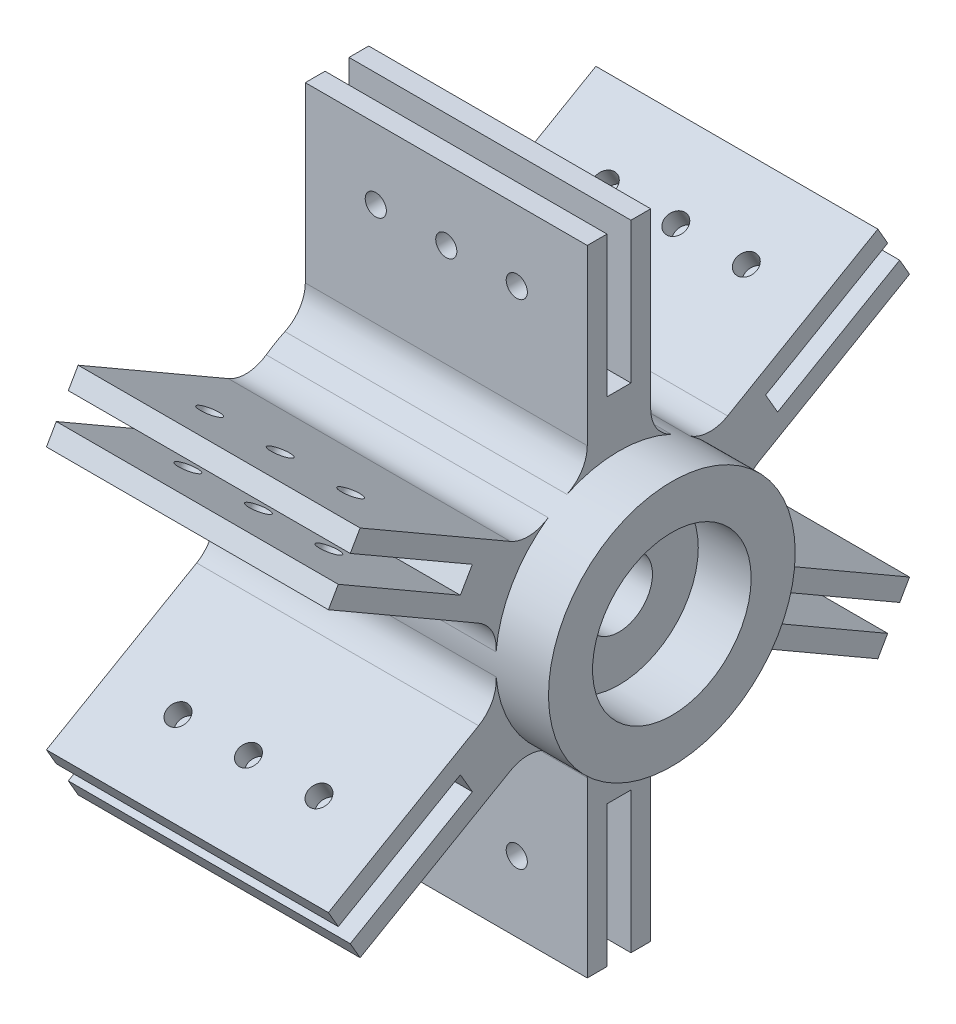
from build123d import *

# Parameters (mm, degrees)
SKETCH1_R                = 17.5
SKETCH1_R_2              = 4.75
MAINBODY_DEPTH           = 40
SKETCH2_R                = 17.5
SKETCH2_R_2              = 11.25
BEARINGHOUSING_DEPTH     = 7.5
SKETCH3_R                = 1.5
MOUNTINGHOLES_DEPTH      = 20
BOSS_EXTRUDE3_DEPTH      = 40
SKETCH6_R                = 1.5
CUT_EXTRUDE2_DEPTH       = 10
FILLET1_R                = 5
CIRPATTERN1_COUNT        = 6
FILLET1_OF_CIRPATTERN1_R = 5


with BuildPart() as part:
    # Sketch1 → MainBody (new body)
    with BuildSketch(Plane(origin=(0, 0, 0), x_dir=(0, 0, -1), z_dir=(1, 0, 0))):
        Circle(SKETCH1_R)
        Circle(SKETCH1_R_2, mode=Mode.SUBTRACT)
    extrude(amount=MAINBODY_DEPTH)

    # Sketch2 → BearingHousing (add)
    with BuildSketch(Plane(origin=(40, 0, 0), x_dir=(0, 0, -1), z_dir=(1, 0, 0))):
        Circle(SKETCH2_R)
        Circle(SKETCH2_R_2, mode=Mode.SUBTRACT)
    extrude(amount=BEARINGHOUSING_DEPTH)

    # Sketch3 → MountingHoles (cut)
    with BuildSketch(Plane.ZY):
        with Locations((0, 13)):
            Circle(SKETCH3_R)
        with Locations((11.258330249, 6.5)):
            Circle(SKETCH3_R)
        with Locations((11.258330249, -6.5)):
            Circle(SKETCH3_R)
        with Locations((0, -13)):
            Circle(SKETCH3_R)
        with Locations((-11.258330249, -6.5)):
            Circle(SKETCH3_R)
        with Locations((-11.258330249, 6.5)):
            Circle(SKETCH3_R)
    extrude(amount=-MOUNTINGHOLES_DEPTH, mode=Mode.SUBTRACT)

    # Sketch4 → Boss-Extrude3 (add)
    with BuildSketch(Plane.ZY):
        with BuildLine():
            Line((-4.5, 16.911534525), (-4.5, 45))
            Line((-4.5, 45), (-1.7, 45))
            Line((-1.7, 45), (-1.7, 25))
            Line((-1.7, 25), (1.7, 25))
            Line((1.7, 25), (1.7, 45))
            Line((1.7, 45), (4.5, 45))
            Line((4.5, 45), (4.5, 16.911534525))
            ThreePointArc((4.5, 16.911534525), (0, 17.5), (-4.5, 16.911534525))
        make_face()
    boss_extrude3 = extrude(amount=-BOSS_EXTRUDE3_DEPTH)

    # Sketch6 → Cut-Extrude2 (cut)
    with BuildSketch(Plane(origin=(0, 0, -4.5), x_dir=(-1, 0, 0), z_dir=(0, 0, -1))):
        with Locations((-30, 35)):
            Circle(SKETCH6_R)
        with Locations((-20, 35)):
            Circle(SKETCH6_R)
        with Locations((-10, 35)):
            Circle(SKETCH6_R)
    cut_extrude2 = extrude(amount=-CUT_EXTRUDE2_DEPTH, mode=Mode.SUBTRACT)

    # Fillet1
    fillet1_edges = [part.edges().sort_by_distance(p)[0] for p in [
        (20, 16.911534525, 4.5),
        (20, 16.911534525, -4.5),
    ]]
    fillet(fillet1_edges, radius=FILLET1_R)

    # CirPattern1: Boss-Extrude3, Cut-Extrude2 ×6 about axis
    cirpattern1_axis = Axis((0, 0, 0), (1, 0, 0))
    add([boss_extrude3.rotate(cirpattern1_axis, i * 360 / CIRPATTERN1_COUNT) for i in range(1, CIRPATTERN1_COUNT)])
    add([cut_extrude2.rotate(cirpattern1_axis, i * 360 / CIRPATTERN1_COUNT) for i in range(1, CIRPATTERN1_COUNT)], mode=Mode.SUBTRACT)

    # Fillet1 of CirPattern1
    fillet1_of_cirpattern1_edges = [part.edges().sort_by_distance(p)[0] for p in [
        (20, 4.558652946, 16.895818516),
        (20, 12.35288158, 12.395818516),
        (20, -12.35288158, 12.395818516),
        (20, -4.558652946, 16.895818516),
        (20, -16.911534525, -4.5),
        (20, -16.911534525, 4.5),
        (20, -4.558652946, -16.895818516),
        (20, -12.35288158, -12.395818516),
        (20, 12.35288158, -12.395818516),
        (20, 4.558652946, -16.895818516),
    ]]
    fillet(fillet1_of_cirpattern1_edges, radius=FILLET1_OF_CIRPATTERN1_R)


solid = part.part
